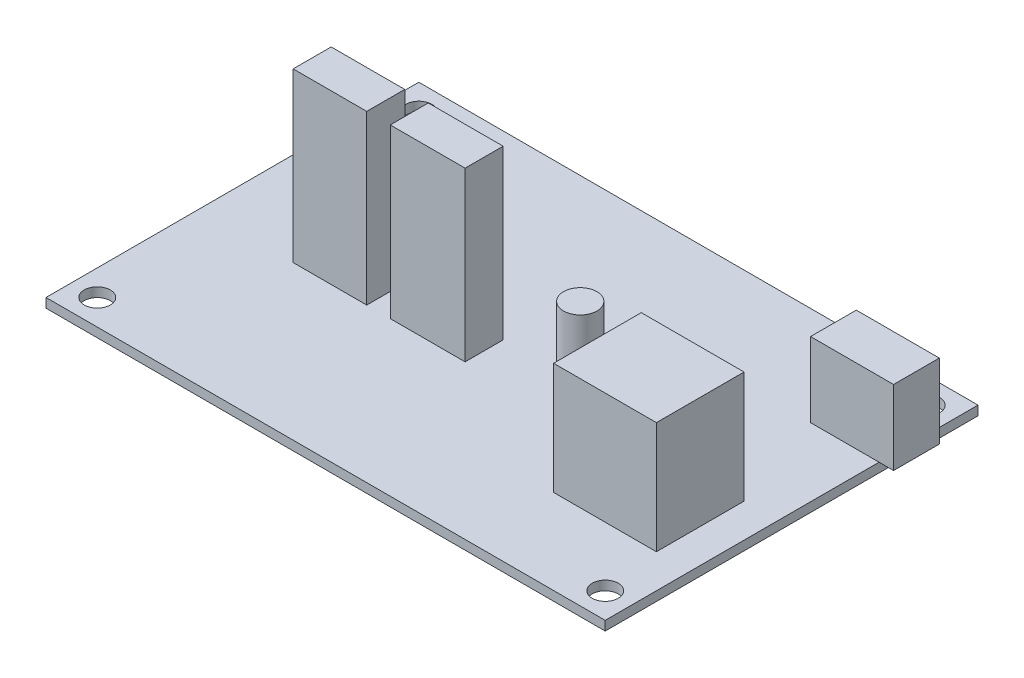
from build123d import *

# Parameters (mm, degrees)
SKETCH1_W           = 60
SKETCH1_H           = 40
BOSS_EXTRUDE1_DEPTH = 1
SKETCH2_R           = 1.4
CUT_EXTRUDE1_DEPTH  = 73.117958928
SKETCH3_R           = 1.794713796
SKETCH3_W           = 11.029321298
SKETCH3_H           = 9.406259618
BOSS_EXTRUDE2_DEPTH = 12
SKETCH4_W           = 8.907146541
SKETCH4_H           = 4.90887134
BOSS_EXTRUDE3_DEPTH = 8
SKETCH5_W           = 7.89622208
SKETCH5_H           = 4.078620146
SKETCH5_W_2         = 8.030698063
BOSS_EXTRUDE4_DEPTH = 18


with BuildPart() as part:
    # Sketch1 → Boss-Extrude1 (new body)
    with BuildSketch(Plane(origin=(0, 0, 0), x_dir=(1, 0, 0), z_dir=(0, 1, 0))):
        with Locations((30, 20)):
            Rectangle(SKETCH1_W, SKETCH1_H)
    extrude(amount=BOSS_EXTRUDE1_DEPTH)

    # Sketch2 → Cut-Extrude1 (cut, through all)
    with BuildSketch(Plane(origin=(0, 1, 0), x_dir=(1, 0, 0), z_dir=(0, 1, 0))):
        with Locations(Location((2.75, 37.25, 0), (0, 0, 270))):
            Circle(SKETCH2_R)
        with Locations(Location((57.25, 37.25, 0), (0, 0, 270))):
            Circle(SKETCH2_R)
        with Locations(Location((57.25, 2.75, 0), (0, 0, 270))):
            Circle(SKETCH2_R)
        with Locations(Location((2.75, 2.75, 0), (0, 0, 270))):
            Circle(SKETCH2_R)
    extrude(amount=-CUT_EXTRUDE1_DEPTH, mode=Mode.SUBTRACT)

    # Sketch3 → Boss-Extrude2 (add)
    with BuildSketch(Plane(origin=(0, 1, 0), x_dir=(1, 0, 0), z_dir=(0, 1, 0))):
        with Locations(Location((41.01670641, 16.304679201, 0), (0, 0, 90))):
            Circle(SKETCH3_R)
        with Locations((50.861034001, 13.82058061)):
            Rectangle(SKETCH3_W, SKETCH3_H)
    extrude(amount=BOSS_EXTRUDE2_DEPTH)

    # Sketch4 → Boss-Extrude3 (add)
    with BuildSketch(Plane(origin=(0, 1, 0), x_dir=(1, 0, 0), z_dir=(0, 1, 0))):
        with Locations((57.100404147, 31.839794384)):
            Rectangle(SKETCH4_W, SKETCH4_H)
    extrude(amount=BOSS_EXTRUDE3_DEPTH)

    # Sketch5 → Boss-Extrude4 (add)
    with BuildSketch(Plane(origin=(0, 1, 0), x_dir=(1, 0, 0), z_dir=(0, 1, 0))):
        with Locations((13.964882377, 18.540826958)):
            Rectangle(SKETCH5_W, SKETCH5_H)
        with Locations((24.451181127, 18.540826958)):
            Rectangle(SKETCH5_W_2, SKETCH5_H)
    extrude(amount=BOSS_EXTRUDE4_DEPTH)


solid = part.part
